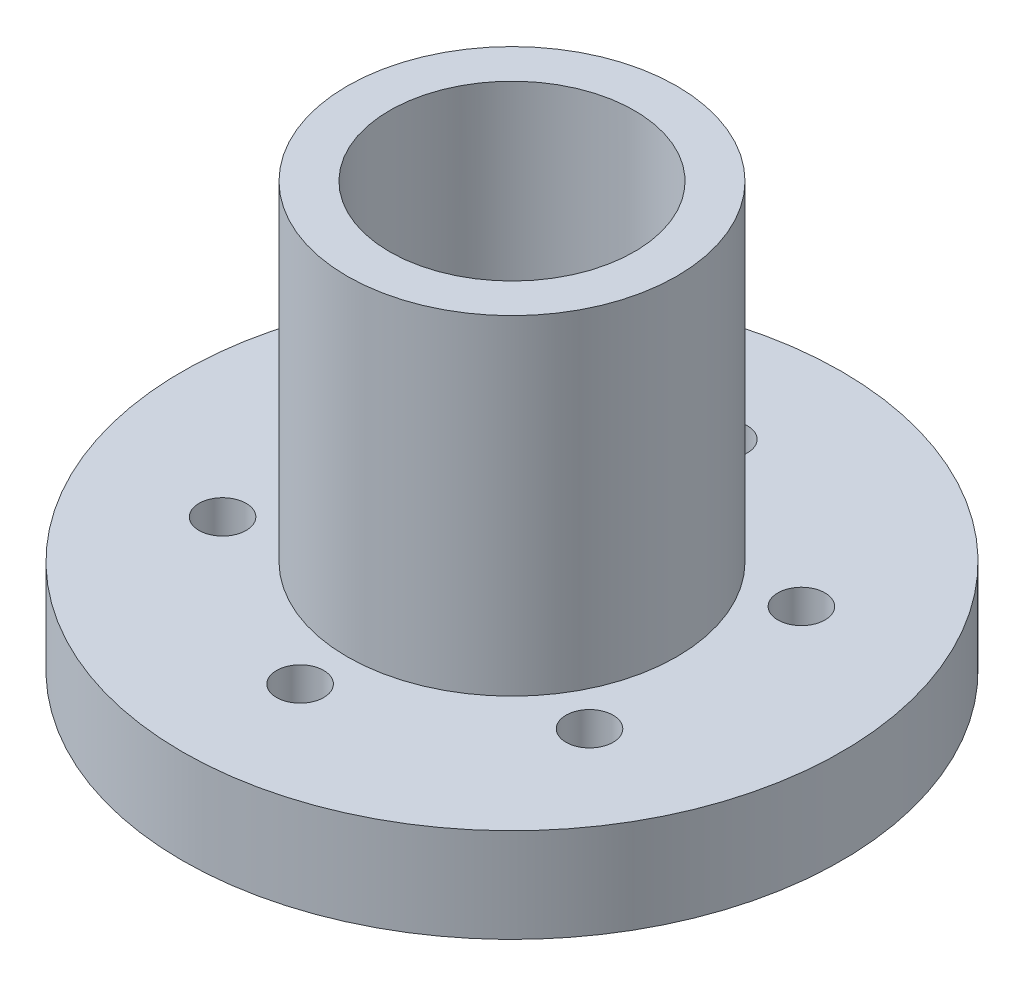
from build123d import *

# Parameters (mm, degrees)
SKETCH1_R           = 35
SKETCH1_R_2         = 5
SKETCH1_R_3         = 2.5
BOSS_EXTRUDE1_DEPTH = 10
SKETCH2_R           = 16
CUT_EXTRUDE1_DEPTH  = 5
SKETCH5_R           = 13
CUT_EXTRUDE2_DEPTH  = 5
BOSS_EXTRUDE2_START = 35
SKETCH6_R           = 17.5
SKETCH6_R_2         = 13
BOSS_EXTRUDE2_DEPTH = 35


with BuildPart() as part:
    # Sketch1 → Boss-Extrude1 (new body)
    with BuildSketch(Plane(origin=(0, 0, 0), x_dir=(1, 0, 0), z_dir=(0, 1, 0))):
        with Locations(Location((0, 0, 0), (0, 0, 270))):
            Circle(SKETCH1_R)
        with Locations(Location((0, 0, 0), (0, 0, 270))):
            Circle(SKETCH1_R_2, mode=Mode.SUBTRACT)
        with Locations(Location((0, 22.5, 0), (0, 0, 270))):
            Circle(SKETCH1_R_3, mode=Mode.SUBTRACT)
        with Locations(Location((19.485571585, 11.25, 0), (0, 0, 270))):
            Circle(SKETCH1_R_3, mode=Mode.SUBTRACT)
        with Locations(Location((19.485571585, -11.25, 0), (0, 0, 270))):
            Circle(SKETCH1_R_3, mode=Mode.SUBTRACT)
        with Locations(Location((0, -22.5, 0), (0, 0, 270))):
            Circle(SKETCH1_R_3, mode=Mode.SUBTRACT)
        with Locations(Location((-19.485571585, -11.25, 0), (0, 0, 270))):
            Circle(SKETCH1_R_3, mode=Mode.SUBTRACT)
        with Locations(Location((-19.485571585, 11.25, 0), (0, 0, 270))):
            Circle(SKETCH1_R_3, mode=Mode.SUBTRACT)
    extrude(amount=BOSS_EXTRUDE1_DEPTH)

    # Sketch2 → Cut-Extrude1 (cut)
    with BuildSketch(Plane.XZ):
        with Locations(Location((0, 0, 0), (0, 0, 270))):
            Circle(SKETCH2_R)
    extrude(amount=-CUT_EXTRUDE1_DEPTH, mode=Mode.SUBTRACT)

    # Sketch5 → Cut-Extrude2 (cut)
    with BuildSketch(Plane(origin=(0, 10, 0), x_dir=(1, 0, 0), z_dir=(0, 1, 0))):
        with Locations(Location((0, 0, 0), (0, 0, 270))):
            Circle(SKETCH5_R)
    extrude(amount=-CUT_EXTRUDE2_DEPTH, mode=Mode.SUBTRACT)

    # Sketch6 → Boss-Extrude2 (add)
    with BuildSketch(Plane(origin=(0, 10, 0), x_dir=(1, 0, 0), z_dir=(0, 1, 0)).offset(BOSS_EXTRUDE2_START)):
        with Locations(Location((0, 0, 0), (0, 0, 270))):
            Circle(SKETCH6_R)
        with Locations(Location((0, 0, 0), (0, 0, 270))):
            Circle(SKETCH6_R_2, mode=Mode.SUBTRACT)
    extrude(amount=-BOSS_EXTRUDE2_DEPTH)


solid = part.part
